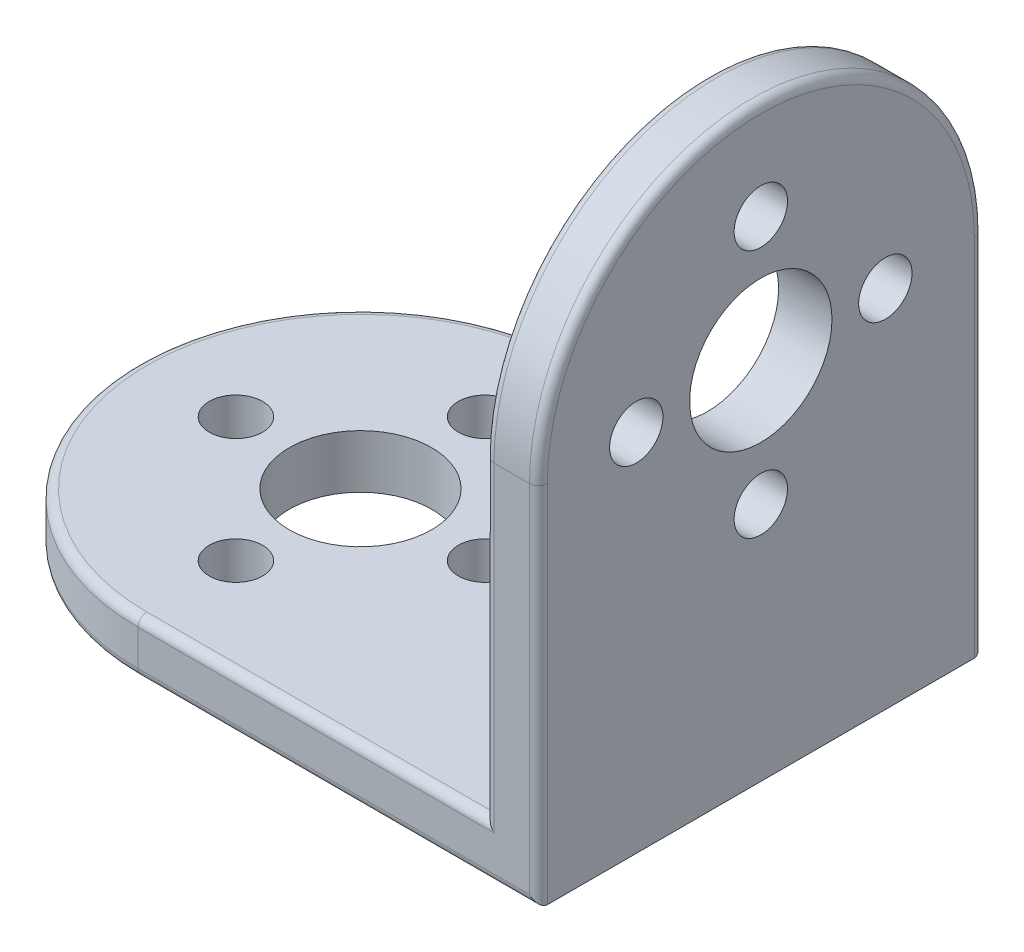
from build123d import *

# Parameters (mm, degrees)
BOSS_EXTRUDE1_DEPTH   = 3
SKETCH2_W             = 3
SKETCH2_H             = 25
BOSS_EXTRUDE2_DEPTH   = 30
CUT_EXTRUDE2_DEPTH    = 3
F_8_0MM_DOWEL_HOLE1_D = 8
F_8_0MM_DOWEL_HOLE2_D = 8
F_3_0MM_DOWEL_HOLE1_D = 3
F_3_0MM_DOWEL_HOLE2_D = 3
FILLET1_R             = 0.5


with BuildPart() as part:
    # Sketch1 → Boss-Extrude1 (new body)
    with BuildSketch(Plane(origin=(0, 0, 0), x_dir=(1, 0, 0), z_dir=(0, 1, 0))):
        with BuildLine():
            Line((-5, 12.5), (17.5, 12.5))
            Line((17.5, 12.5), (17.5, -12.5))
            Line((17.5, -12.5), (-5, -12.5))
            ThreePointArc((-5, -12.5), (-17.5, 0), (-5, 12.5))
        make_face()
    extrude(amount=BOSS_EXTRUDE1_DEPTH)

    # Sketch2 → Boss-Extrude2 (add)
    with BuildSketch(Plane(origin=(0, 3, 0), x_dir=(1, 0, 0), z_dir=(0, 1, 0))):
        with Locations((16, 0)):
            Rectangle(SKETCH2_W, SKETCH2_H)
    extrude(amount=BOSS_EXTRUDE2_DEPTH)

    # Sketch3 → Cut-Extrude2 (cut)
    with BuildSketch(Plane(origin=(17.5, 0, 0), x_dir=(0, 0, -1), z_dir=(1, 0, 0))):
        with BuildLine():
            Line((0, 33), (-12.5, 33))
            Line((-12.5, 33), (-12.5, 20.5))
            ThreePointArc((-12.5, 20.5), (-8.838834765, 29.338834765), (0, 33))
        make_face()
        with BuildLine():
            Line((12.5, 33), (0, 33))
            ThreePointArc((0, 33), (8.838834765, 29.338834765), (12.5, 20.5))
            Line((12.5, 20.5), (12.5, 33))
        make_face()
    extrude(amount=-CUT_EXTRUDE2_DEPTH, mode=Mode.SUBTRACT)

    # Ø8.0mm Dowel Hole1 (through all)
    with Locations(Plane(origin=(17.5, 0, 0), x_dir=(0, 0, -1), z_dir=(1, 0, 0))):
        with Locations((0, 20.5)):
            Hole(F_8_0MM_DOWEL_HOLE1_D / 2)

    # Ø8.0mm Dowel Hole2 (through all)
    with Locations(Plane(origin=(0, 3, 0), x_dir=(1, 0, 0), z_dir=(0, 1, 0))):
        with Locations((-5, 0)):
            Hole(F_8_0MM_DOWEL_HOLE2_D / 2)

    # Ø3.0mm Dowel Hole1 (through all)
    with Locations(Plane(origin=(17.5, 0, 0), x_dir=(0, 0, -1), z_dir=(1, 0, 0))):
        with Locations((0, 27.5), (7, 20.5), (0, 13.5), (-7, 20.5), (0, 20.5)):
            Hole(F_3_0MM_DOWEL_HOLE1_D / 2)

    # Ø3.0mm Dowel Hole2 (through all)
    with Locations(Plane(origin=(0, 3, 0), x_dir=(1, 0, 0), z_dir=(0, 1, 0))):
        with Locations((-12, 0), (-5, 7), (2, 0), (-5, -7), (-5, 0)):
            Hole(F_3_0MM_DOWEL_HOLE2_D / 2)

    # Fillet1
    fillet1_edges = [part.edges().sort_by_distance(p)[0] for p in [
        (4.75, 3, -12.5),
        (14.5, 11.75, 12.5),
        (17.5, 10.25, 12.5),
        (17.5, 33, 0),
        (14.5, 33, 0),
        (14.5, 11.75, -12.5),
        (17.5, 10.25, -12.5),
        (-17.5, 3, 0),
        (6.25, 0, -12.5),
        (6.25, 0, 12.5),
        (-17.5, 0, 0),
        (4.75, 3, 12.5),
    ]]
    fillet(fillet1_edges, radius=FILLET1_R)


solid = part.part
